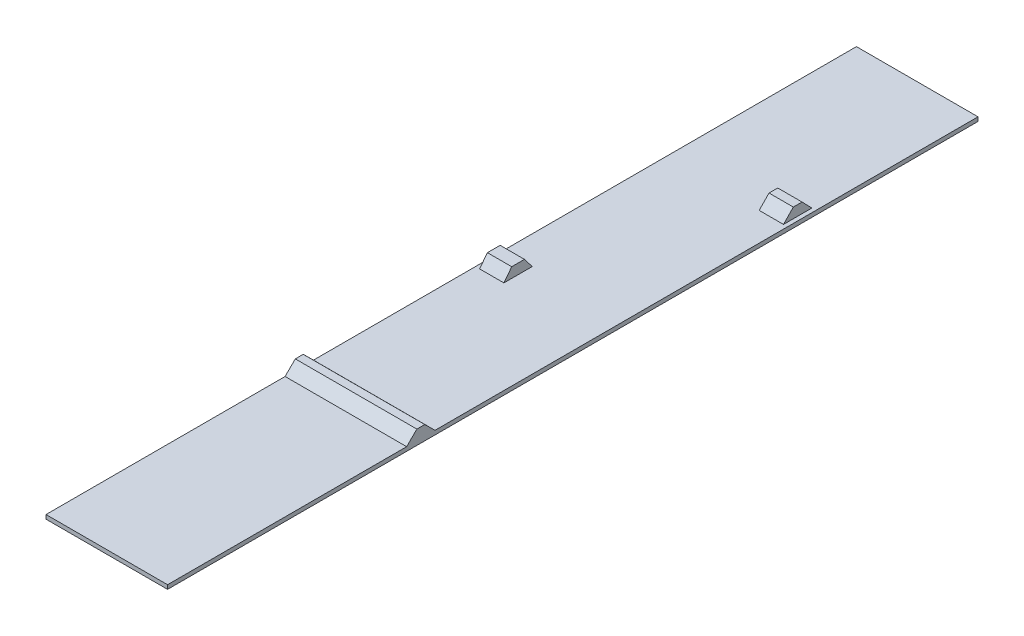
from build123d import *

# Parameters (mm, degrees)
SKETCH1_W                = 300
SKETCH1_H                = 2000
BOSS_EXTRUDE1_DEPTH      = 10
BOSS_EXTRUDE2_START      = 80
BOSS_EXTRUDE2_DEPTH      = 60
BOSS_EXTRUDE3_START      = -140
BOSS_EXTRUDE3_DEPTH      = 60
BOSS_EXTRUDE4_DEPTH      = 150
BOSS_EXTRUDE4_DEPTH_BACK = 150


with BuildPart() as part:
    # Sketch1 → Boss-Extrude1 (new body)
    with BuildSketch(Plane(origin=(0, 0, 0), x_dir=(1, 0, 0), z_dir=(0, 1, 0))):
        Rectangle(SKETCH1_W, SKETCH1_H)
    extrude(amount=BOSS_EXTRUDE1_DEPTH)

    # Sketch2 → Boss-Extrude2 (add)
    with BuildSketch(Plane(origin=(0, 0, 0), x_dir=(0, 0, -1), z_dir=(1, 0, 0)).offset(BOSS_EXTRUDE2_START)):
        Polygon((530, 10), (554.216468309, 35), (575.783531691, 35), (600, 10), align=None)
    extrude(amount=BOSS_EXTRUDE2_DEPTH)

    # Sketch3 → Boss-Extrude3 (add)
    with BuildSketch(Plane(origin=(0, 0, 0), x_dir=(0, 0, -1), z_dir=(1, 0, 0)).offset(BOSS_EXTRUDE3_START)):
        Polygon((60, 10), (79.278295144, 35), (110.721704856, 35), (130, 10), align=None)
    extrude(amount=BOSS_EXTRUDE3_DEPTH)

    # Sketch4 → Boss-Extrude4 (add, two sides: drawn at the far end of the back side and taken through both)
    with BuildSketch(Plane(origin=(0, 0, 0), x_dir=(0, 0, -1), z_dir=(1, 0, 0)).offset(-BOSS_EXTRUDE4_DEPTH_BACK)):
        Polygon((-410, 10), (-384.771871556, 35), (-365.228128444, 35), (-340, 10), align=None)
    extrude(amount=BOSS_EXTRUDE4_DEPTH + BOSS_EXTRUDE4_DEPTH_BACK)


solid = part.part
